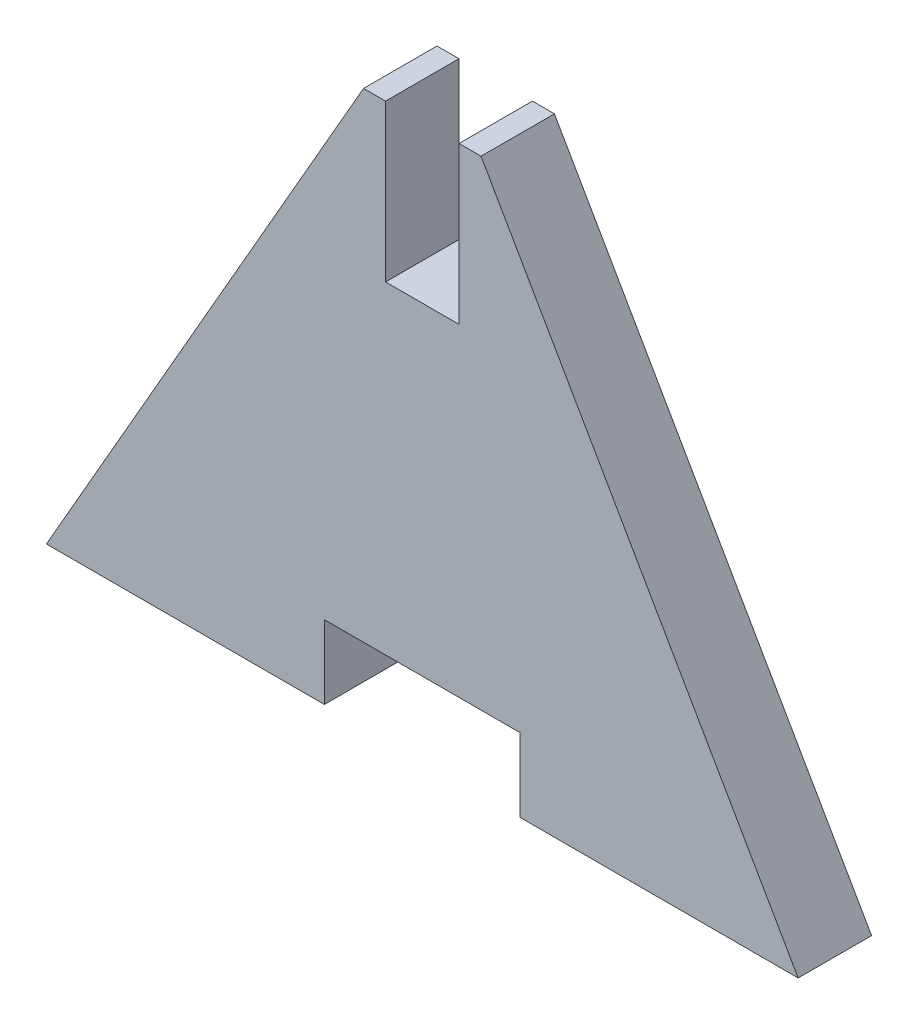
from build123d import *

# Parameters (mm, degrees)
BOSS_EXTRUDE1_DEPTH = 4.7625
CUT_EXTRUDE1_DEPTH  = 50.252795761
SKETCH4_W           = 4.7625
SKETCH4_H           = 4.7625
CUT_EXTRUDE2_DEPTH  = 10.16


with BuildPart() as part:
    # Sketch1 → Boss-Extrude1 (new body)
    with BuildSketch(Plane.XY):
        Polygon((0, 42.527367988), (24.384, 0), (-24.384, 0), align=None)
    extrude(amount=BOSS_EXTRUDE1_DEPTH)

    # Sketch2 → Cut-Extrude1 (cut, through all)
    with BuildSketch(Plane.XY.offset(4.7625)):
        Polygon((0, 0), (-6.35, 0), (-6.35, 4.7625), (6.35, 4.7625), (6.35, 0), align=None)
        Polygon((0, 42.527367988), (-3.81, 35.88246674), (3.81, 35.88246674), align=None)
    extrude(amount=-CUT_EXTRUDE1_DEPTH, mode=Mode.SUBTRACT)

    # Sketch4 → Cut-Extrude2 (cut)
    with BuildSketch(Plane(origin=(0, 35.88246674, 0), x_dir=(1, 0, 0), z_dir=(0, 1, 0))):
        with Locations((0, -2.38125)):
            Rectangle(SKETCH4_W, SKETCH4_H)
    extrude(amount=-CUT_EXTRUDE2_DEPTH, mode=Mode.SUBTRACT)


solid = part.part
